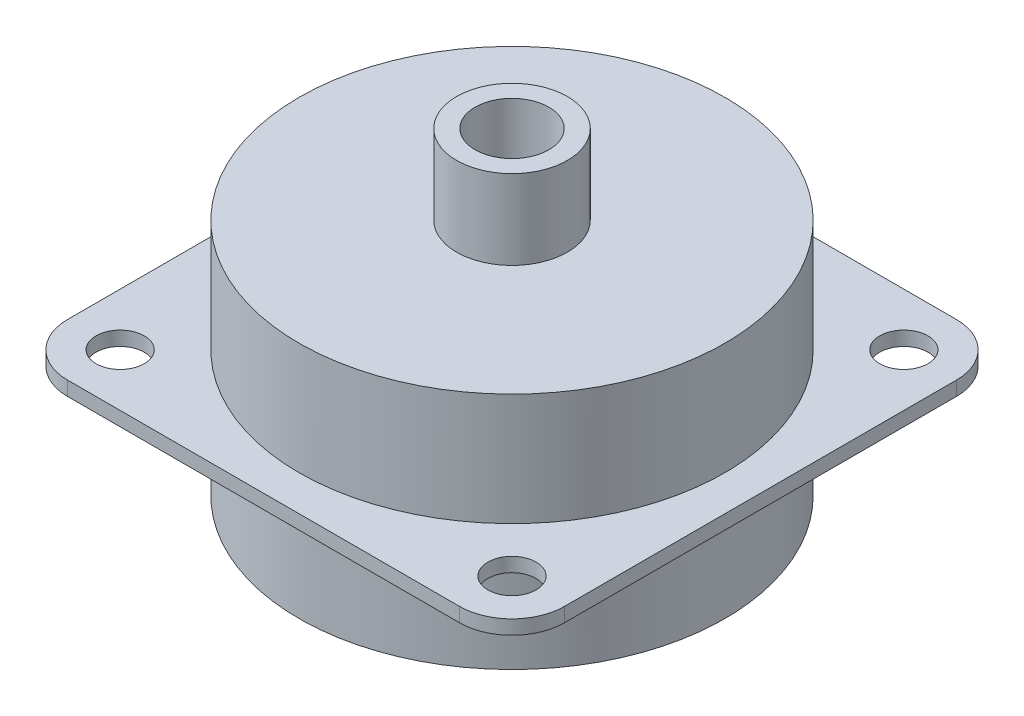
from build123d import *

# Parameters (mm, degrees)
SKETCH3_R           = 19.05
SKETCH3_R_2         = 2.159
BOSS_EXTRUDE1_DEPTH = 1.27


with BuildPart() as part:
    # Sketch2 → Revolve1 (revolve)
    with BuildSketch(Plane.XY, mode=Mode.PRIVATE) as revolve1_sk:
        Polygon((3.302, 35.814), (4.953, 35.814), (4.953, 28.702), (19.05, 28.702), (19.05, 18.669), (19.05, 17.399), (19.05, 7.366), (3.302, 7.366), align=None)
    revolve(revolve1_sk.sketch.rotate(Axis((0, 35.814, 0), (0, -1, 0)), 180), axis=Axis((0, 35.814, 0), (0, -1, 0)))

    # Sketch3 → Boss-Extrude1 (add)
    with BuildSketch(Plane(origin=(0, 17.399, 0), x_dir=(1, 0, 0), z_dir=(0, 1, 0))):
        with BuildLine():
            Line((-17.526, 22.225), (17.526, 22.225))
            ThreePointArc((17.526, 22.225), (20.848694765, 20.848694765), (22.225, 17.526))
            Line((22.225, 17.526), (22.225, -17.526))
            ThreePointArc((22.225, -17.526), (20.848694765, -20.848694765), (17.526, -22.225))
            Line((17.526, -22.225), (-17.526, -22.225))
            ThreePointArc((-17.526, -22.225), (-20.848694765, -20.848694765), (-22.225, -17.526))
            Line((-22.225, -17.526), (-22.225, 17.526))
            ThreePointArc((-22.225, 17.526), (-20.848694765, 20.848694765), (-17.526, 22.225))
        make_face()
        with Locations(Location((0, 0, 0), (0, 0, 180))):
            Circle(SKETCH3_R, mode=Mode.SUBTRACT)
        with Locations(Location((-17.526, -17.526, 0), (0, 0, 270))):
            Circle(SKETCH3_R_2, mode=Mode.SUBTRACT)
        with Locations(Location((17.526, -17.526, 0), (0, 0, 270))):
            Circle(SKETCH3_R_2, mode=Mode.SUBTRACT)
        with Locations(Location((-17.526, 17.526, 0), (0, 0, 270))):
            Circle(SKETCH3_R_2, mode=Mode.SUBTRACT)
        with Locations(Location((17.526, 17.526, 0), (0, 0, 270))):
            Circle(SKETCH3_R_2, mode=Mode.SUBTRACT)
    extrude(amount=BOSS_EXTRUDE1_DEPTH)


solid = part.part
